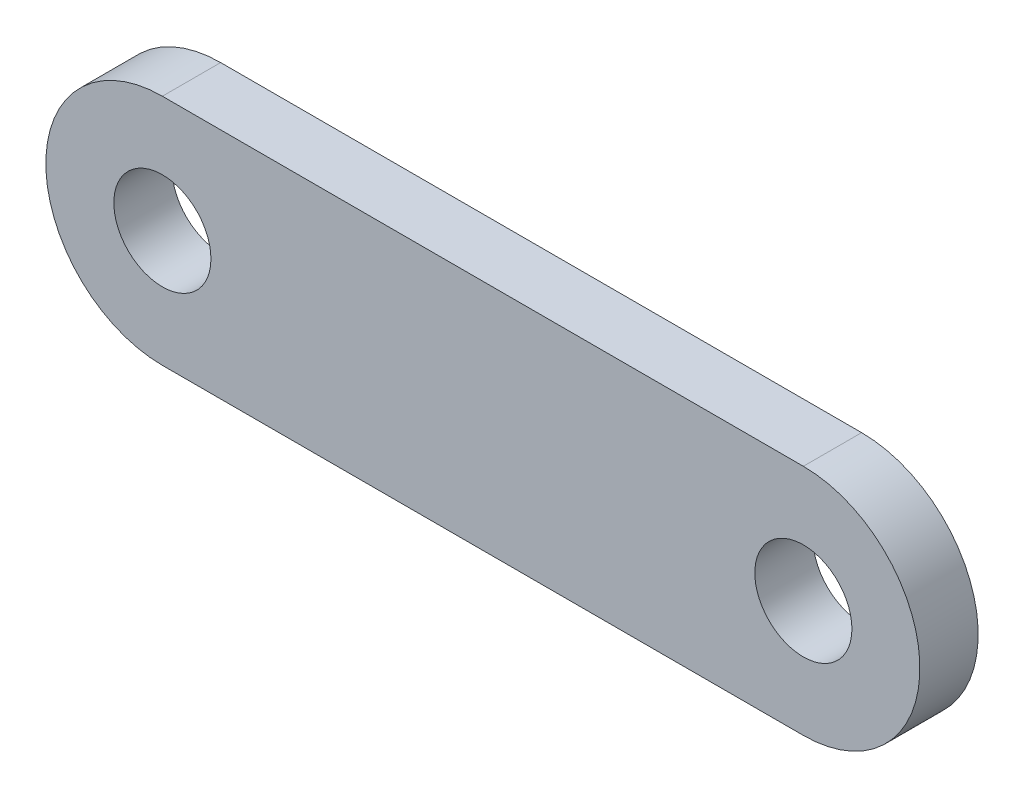
from build123d import *

# Parameters (mm, degrees)
EXTRUDE_1_DEPTH = 3


with BuildPart() as part:
    # 草图1 → 凸台-拉伸1 (new body)
    with BuildSketch(Plane.XY):
        with BuildLine():
            ThreePointArc((0, 6), (4.242640687, 4.242640687), (6, 0))
            Line((6, 0), (27, 0))
            ThreePointArc((27, 0), (28.757359313, 4.242640687), (33, 6))
            Line((33, 6), (0, 6))
        make_face()
        with BuildLine():
            Line((27, 0), (6, 0))
            ThreePointArc((6, 0), (4.242640687, -4.242640687), (0, -6))
            Line((0, -6), (33, -6))
            ThreePointArc((33, -6), (28.757359313, -4.242640687), (27, 0))
        make_face()
        with BuildLine():
            ThreePointArc((-2.5, 0), (0, 2.5), (2.5, 0))
            Line((2.5, 0), (6, 0))
            ThreePointArc((6, 0), (4.242640687, 4.242640687), (0, 6))
            ThreePointArc((0, 6), (-4.242640687, 4.242640687), (-6, 0))
            Line((-6, 0), (-2.5, 0))
        make_face()
        with BuildLine():
            Line((6, 0), (2.5, 0))
            ThreePointArc((2.5, 0), (0, -2.5), (-2.5, 0))
            Line((-2.5, 0), (-6, 0))
            ThreePointArc((-6, 0), (-4.242640687, -4.242640687), (0, -6))
            ThreePointArc((0, -6), (4.242640687, -4.242640687), (6, 0))
        make_face()
        with BuildLine():
            ThreePointArc((33, 6), (28.757359313, 4.242640687), (27, 0))
            Line((27, 0), (30.5, 0))
            ThreePointArc((30.5, 0), (33, 2.5), (35.5, 0))
            Line((35.5, 0), (39, 0))
            ThreePointArc((39, 0), (37.242640687, 4.242640687), (33, 6))
        make_face()
        with BuildLine():
            Line((30.5, 0), (27, 0))
            ThreePointArc((27, 0), (28.757359313, -4.242640687), (33, -6))
            ThreePointArc((33, -6), (37.242640687, -4.242640687), (39, 0))
            Line((39, 0), (35.5, 0))
            ThreePointArc((35.5, 0), (33, -2.5), (30.5, 0))
        make_face()
    extrude(amount=EXTRUDE_1_DEPTH)


solid = part.part
